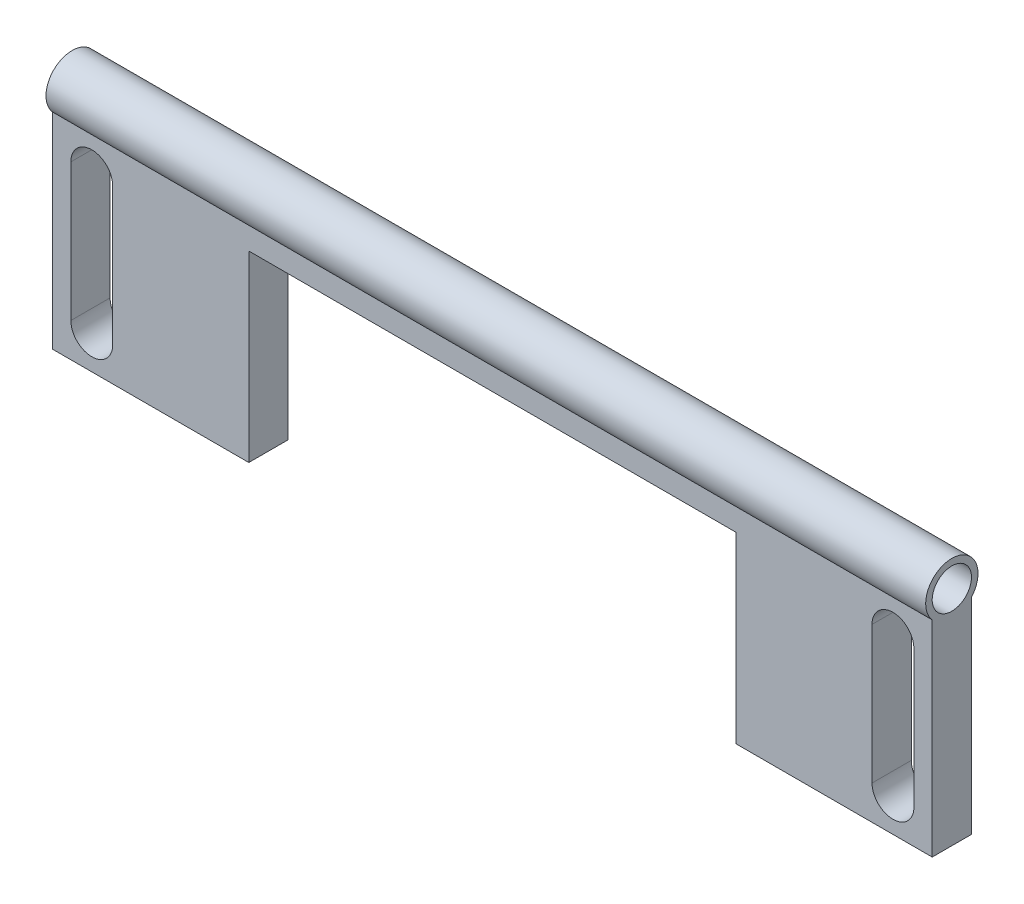
from build123d import *

# Parameters (mm, degrees)
SKETCH1_R           = 1.5
BOSS_EXTRUDE1_DEPTH = 33.615
CUT_EXTRUDE1_DEPTH  = 39.782573705
SKETCH3_W           = 37.23
SKETCH3_H           = 14
CUT_EXTRUDE3_DEPTH  = 10


with BuildPart() as part:
    # Sketch1 → Boss-Extrude1 (new body)
    with BuildSketch(Plane(origin=(0, 0, 0), x_dir=(0, 0, -1), z_dir=(1, 0, 0))):
        with BuildLine():
            ThreePointArc((0, 15.7), (1.5, 19.022875656), (3, 15.7))
            Line((3, 15.7), (3, 0))
            Line((3, 0), (0, 0))
            Line((0, 0), (0, 15.7))
        make_face()
        with Locations((1.5, 17.022875656)):
            Circle(SKETCH1_R, mode=Mode.SUBTRACT)
    boss_extrude1 = extrude(amount=BOSS_EXTRUDE1_DEPTH)

    # Sketch2 → Cut-Extrude1 (cut, through all)
    with BuildSketch(Plane(origin=(0, 0, -3), x_dir=(-1, 0, 0), z_dir=(0, 0, -1))):
        with BuildLine():
            Line((-1.4, 13.1), (-1.4, 2.6))
            ThreePointArc((-1.4, 2.6), (-3, 1), (-4.6, 2.6))
            Line((-4.6, 2.6), (-4.6, 13.1))
            ThreePointArc((-4.6, 13.1), (-3, 14.7), (-1.4, 13.1))
        make_face()
    cut_extrude1 = extrude(amount=-CUT_EXTRUDE1_DEPTH, mode=Mode.SUBTRACT)

    # Mirror1: Boss-Extrude1, Cut-Extrude1 across plane
    add(boss_extrude1.mirror(Plane(origin=(33.615, 0, 0), x_dir=(0, 0, 1), z_dir=(1, 0, 0))))
    add(cut_extrude1.mirror(Plane(origin=(33.615, 0, 0), x_dir=(0, 0, 1), z_dir=(1, 0, 0))), mode=Mode.SUBTRACT)

    # Sketch3 → Cut-Extrude3 (cut)
    with BuildSketch(Plane(origin=(0, 0, -3), x_dir=(-1, 0, 0), z_dir=(0, 0, -1))):
        with Locations((-33.615, 7)):
            Rectangle(SKETCH3_W, SKETCH3_H)
    extrude(amount=-CUT_EXTRUDE3_DEPTH, mode=Mode.SUBTRACT)


solid = part.part
